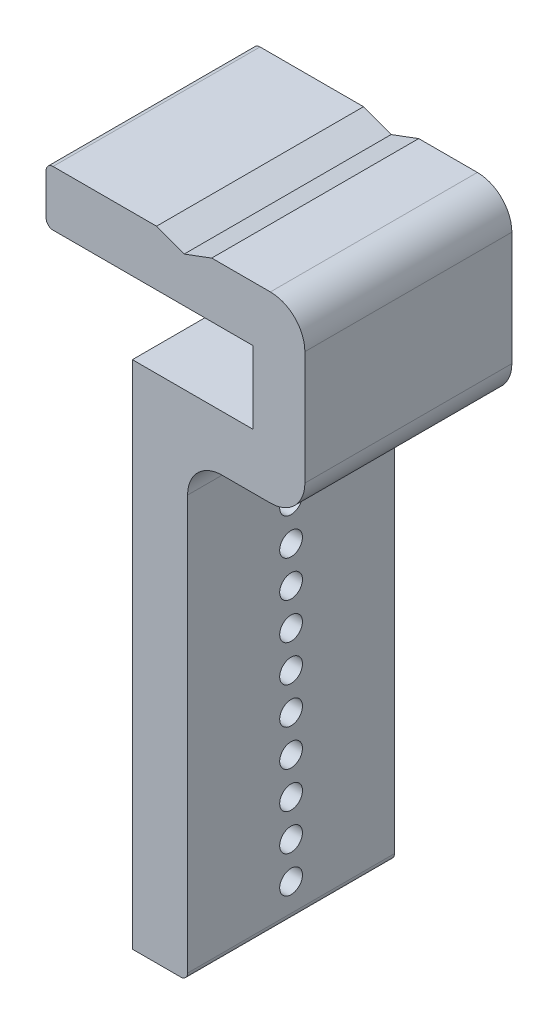
from build123d import *

# Parameters (mm, degrees)
BOSS_EXTRUDE1_DEPTH = 30
CUT_EXTRUDE1_DEPTH  = 30
BOSS_EXTRUDE3_DEPTH = 30
SKETCH5_W           = 8
SKETCH5_H           = 30
BOSS_EXTRUDE4_DEPTH = 50
SKETCH6_R           = 1.65
CUT_EXTRUDE2_DEPTH  = 40
CUT_EXTRUDE3_DEPTH  = 65
FILLET1_R           = 5
FILLET3_R           = 1
FILLET4_R           = 1


with BuildPart() as part:
    # Sketch1 → Boss-Extrude1 (new body)
    with BuildSketch(Plane.XY):
        Polygon((-14.5, 13.25), (-14.5, 5.25), (15, 5.25), (15.5, 5.25), (15.5, -5.25), (15, -5.25), (-2, -5.25), (-2, -8.570490336), (-2, -29.25), (6, -29.25), (6, -13.25), (23, -13.25), (23, 13.25), align=None)
    extrude(amount=BOSS_EXTRUDE1_DEPTH)

    # Sketch3 → Cut-Extrude1 (cut)
    with BuildSketch(Plane.XY.offset(30)):
        Polygon((1.5, 13.25), (9.5, 13.25), (5.5, 11.75), align=None)
    extrude(amount=-CUT_EXTRUDE1_DEPTH, mode=Mode.SUBTRACT)

    # Sketch4 → Boss-Extrude3 (add)
    with BuildSketch(Plane.ZY.offset(14.5)):
        Polygon((5, 5.25), (25, 5.25), (15, 2.25), align=None)
    extrude(amount=-BOSS_EXTRUDE3_DEPTH)

    # Sketch5 → Boss-Extrude4 (add)
    with BuildSketch(Plane.XZ.offset(29.25)):
        with Locations((2, 15)):
            Rectangle(SKETCH5_W, SKETCH5_H)
    extrude(amount=BOSS_EXTRUDE4_DEPTH)

    # Sketch6 → Cut-Extrude2 (cut)
    with BuildSketch(Plane(origin=(6, 0, 0), x_dir=(0, 0, -1), z_dir=(1, 0, 0))):
        with BuildLine():
            ThreePointArc((-13.35, -31.85), (-13.833273811, -30.683273811), (-15, -30.2))
            Line((-15, -30.2), (-15, -33.5))
            ThreePointArc((-15, -33.5), (-13.833273811, -33.016726189), (-13.35, -31.85))
        make_face()
        with BuildLine():
            Line((-15, -33.5), (-15, -30.2))
            ThreePointArc((-15, -30.2), (-16.65, -31.85), (-15, -33.5))
        make_face()
        with BuildLine():
            ThreePointArc((-13.35, -37.15), (-13.833273811, -35.983273811), (-15, -35.5))
            Line((-15, -35.5), (-15, -38.8))
            ThreePointArc((-15, -38.8), (-13.833273811, -38.316726189), (-13.35, -37.15))
        make_face()
        with BuildLine():
            Line((-15, -38.8), (-15, -35.5))
            ThreePointArc((-15, -35.5), (-16.65, -37.15), (-15, -38.8))
        make_face()
        with BuildLine():
            ThreePointArc((-13.35, -42.45), (-13.833273811, -41.283273811), (-15, -40.8))
            Line((-15, -40.8), (-15, -44.1))
            ThreePointArc((-15, -44.1), (-13.833273811, -43.616726189), (-13.35, -42.45))
        make_face()
        with BuildLine():
            Line((-15, -44.1), (-15, -40.8))
            ThreePointArc((-15, -40.8), (-16.65, -42.45), (-15, -44.1))
        make_face()
        with BuildLine():
            ThreePointArc((-13.35, -47.75), (-13.833273811, -46.583273811), (-15, -46.1))
            Line((-15, -46.1), (-15, -49.4))
            ThreePointArc((-15, -49.4), (-13.833273811, -48.916726189), (-13.35, -47.75))
        make_face()
        with BuildLine():
            Line((-15, -49.4), (-15, -46.1))
            ThreePointArc((-15, -46.1), (-16.65, -47.75), (-15, -49.4))
        make_face()
        with BuildLine():
            ThreePointArc((-13.35, -53.05), (-13.833273811, -51.883273811), (-15, -51.4))
            Line((-15, -51.4), (-15, -54.7))
            ThreePointArc((-15, -54.7), (-13.833273811, -54.216726189), (-13.35, -53.05))
        make_face()
        with BuildLine():
            Line((-15, -54.7), (-15, -51.4))
            ThreePointArc((-15, -51.4), (-16.65, -53.05), (-15, -54.7))
        make_face()
        with BuildLine():
            ThreePointArc((-13.35, -58.35), (-13.833273811, -57.183273811), (-15, -56.7))
            Line((-15, -56.7), (-15, -60))
            ThreePointArc((-15, -60), (-13.833273811, -59.516726189), (-13.35, -58.35))
        make_face()
        with BuildLine():
            Line((-15, -60), (-15, -56.7))
            ThreePointArc((-15, -56.7), (-16.65, -58.35), (-15, -60))
        make_face()
        with BuildLine():
            ThreePointArc((-13.35, -63.65), (-13.833273811, -62.483273811), (-15, -62))
            Line((-15, -62), (-15, -65.3))
            ThreePointArc((-15, -65.3), (-13.833273811, -64.816726189), (-13.35, -63.65))
        make_face()
        with BuildLine():
            Line((-15, -65.3), (-15, -62))
            ThreePointArc((-15, -62), (-16.65, -63.65), (-15, -65.3))
        make_face()
        with BuildLine():
            ThreePointArc((-13.35, -68.95), (-13.833273811, -67.783273811), (-15, -67.3))
            Line((-15, -67.3), (-15, -70.6))
            ThreePointArc((-15, -70.6), (-13.833273811, -70.116726189), (-13.35, -68.95))
        make_face()
        with BuildLine():
            Line((-15, -70.6), (-15, -67.3))
            ThreePointArc((-15, -67.3), (-16.65, -68.95), (-15, -70.6))
        make_face()
        with BuildLine():
            ThreePointArc((-13.35, -74.25), (-13.833273811, -73.083273811), (-15, -72.6))
            Line((-15, -72.6), (-15, -75.9))
            ThreePointArc((-15, -75.9), (-13.833273811, -75.416726189), (-13.35, -74.25))
        make_face()
        with BuildLine():
            Line((-15, -75.9), (-15, -72.6))
            ThreePointArc((-15, -72.6), (-16.65, -74.25), (-15, -75.9))
        make_face()
        with Locations(Location((-15, -26.55, 0), (0, 0, 90))):
            Circle(SKETCH6_R)
        with Locations(Location((-15, -21.25, 0), (0, 0, 90))):
            Circle(SKETCH6_R)
    extrude(amount=-CUT_EXTRUDE2_DEPTH, mode=Mode.SUBTRACT)

    # Sketch7 → Cut-Extrude3 (cut)
    with BuildSketch(Plane.XZ.offset(79.25)):
        Polygon((-2, 27.5), (-2, 2.5), (2, 15), align=None)
    extrude(amount=-CUT_EXTRUDE3_DEPTH, mode=Mode.SUBTRACT)

    # Fillet1
    fillet1_edges = [part.edges().sort_by_distance(p)[0] for p in [
        (23, 13.25, 15),
        (23, -13.25, 15),
        (6, -13.25, 15),
    ]]
    fillet(fillet1_edges, radius=FILLET1_R)

    # Fillet3
    fillet3_edges = [part.edges().sort_by_distance(p)[0] for p in [
        (6, -79.25, 15),
    ]]
    fillet(fillet3_edges, radius=FILLET3_R)

    # Fillet4
    fillet4_edges = [part.edges().sort_by_distance(p)[0] for p in [
        (-14.5, 5.25, 27.5),
        (-14.5, 13.25, 15),
        (-14.5, 5.25, 2.5),
        (-14.5, 3.75, 20),
        (-14.5, 3.75, 10),
    ]]
    fillet(fillet4_edges, radius=FILLET4_R)


solid = part.part
